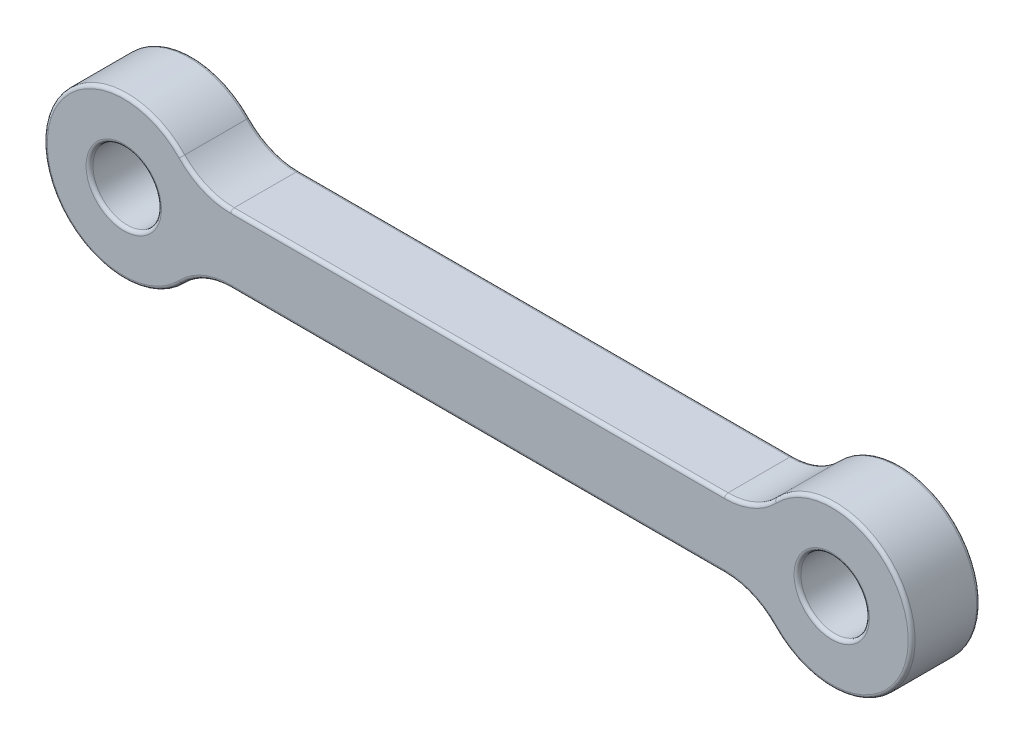
from build123d import *

# Parameters (mm, degrees)
SKETCH_1_R      = 3.5
SKETCH_1_R_2    = 1.5
EXTRUDE_1_DEPTH = 3
FILLET_1_R      = 3
FILLET_2_R      = 0.15


with BuildPart() as part:
    # Эскиз1 → Бобышка-Вытянуть1 (new body)
    # profile 1 of 3: a face of its own
    with BuildSketch(Plane.XY):
        Circle(SKETCH_1_R)
        Circle(SKETCH_1_R_2, mode=Mode.SUBTRACT)
    # profile 2 of 3: a face of its own
    with BuildSketch(Plane.XY):
        with BuildLine():
            Line((3.16227766, -1.5), (27.83772234, -1.5))
            ThreePointArc((27.83772234, -1.5), (27.5, 0), (27.83772234, 1.5))
            Line((27.83772234, 1.5), (3.16227766, 1.5))
            ThreePointArc((3.16227766, 1.5), (3.414525722, 0.768774411), (3.5, 0))
            ThreePointArc((3.5, 0), (3.414525722, -0.768774411), (3.16227766, -1.5))
        make_face()
    # profile 3 of 3: a face of its own
    with BuildSketch(Plane.XY):
        with Locations((31, 0)):
            Circle(SKETCH_1_R)
        with Locations((31, 0)):
            Circle(SKETCH_1_R_2, mode=Mode.SUBTRACT)
    extrude(amount=EXTRUDE_1_DEPTH)

    # Скругление1
    fillet_1_edges = [part.edges().sort_by_distance(p)[0] for p in [
        (3.16227766, 1.5, 1.5),
        (27.83772234, 1.5, 1.5),
        (27.83772234, -1.5, 1.5),
        (3.16227766, -1.5, 1.5),
    ]]
    fillet(fillet_1_edges, radius=FILLET_1_R)

    # Скругление2
    fillet_2_edges = [part.edges().sort_by_distance(p)[0] for p in [
        (-1.5, 0, 0),
        (15.5, 1.5, 0),
        (15.5, 1.5, 3),
        (34.5, 0, 0),
        (34.5, 0, 3),
        (-3.5, 0, 0),
        (-3.5, 0, 3),
        (15.5, -1.5, 0),
        (15.5, -1.5, 3),
        (27.486281051, 1.740401367, 0),
        (27.486281051, 1.740401367, 3),
        (3.513718949, 1.740401367, 0),
        (3.513718949, 1.740401367, 3),
        (29.5, 0, 3),
        (27.486281051, -1.740401367, 0),
        (27.486281051, -1.740401367, 3),
        (3.513718949, -1.740401367, 0),
        (3.513718949, -1.740401367, 3),
        (-1.5, 0, 3),
        (29.5, 0, 0),
    ]]
    fillet(fillet_2_edges, radius=FILLET_2_R)


solid = part.part
